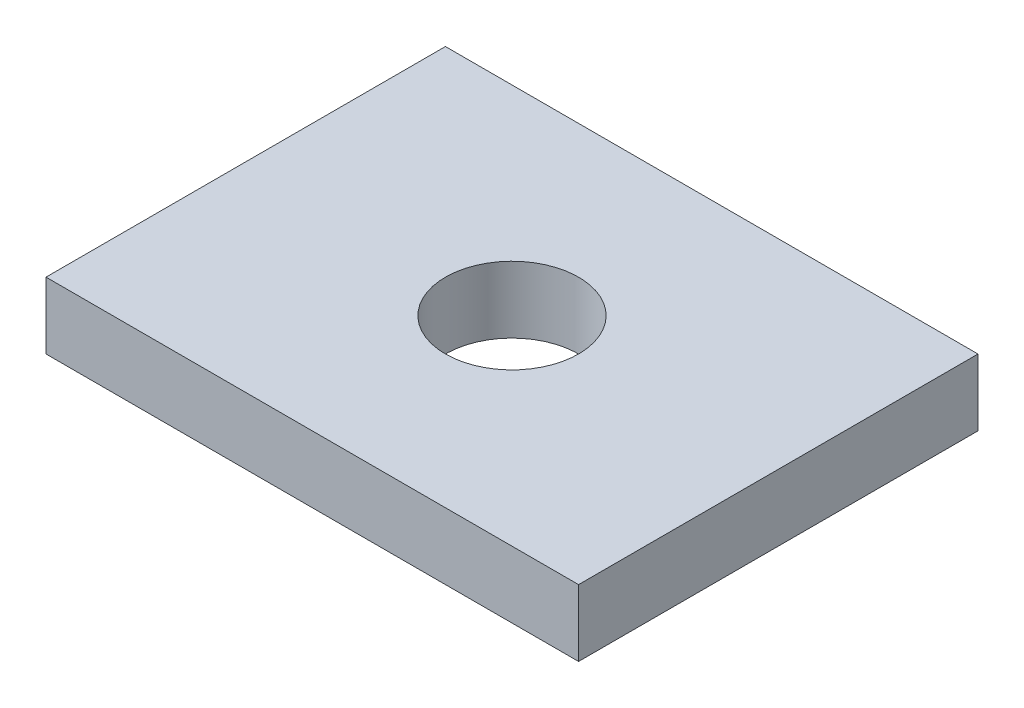
from build123d import *

# Parameters (mm, degrees)
SKETCH1_W           = 80
SKETCH1_H           = 60
SKETCH1_R           = 10
BOSS_EXTRUDE1_DEPTH = 10


with BuildPart() as part:
    # Sketch1 → Boss-Extrude1 (new body)
    with BuildSketch(Plane(origin=(0, 0, 0), x_dir=(1, 0, 0), z_dir=(0, 1, 0))):
        Rectangle(SKETCH1_W, SKETCH1_H)
        with Locations(Location((0, 0, 0), (0, 0, 270))):
            Circle(SKETCH1_R, mode=Mode.SUBTRACT)
    extrude(amount=BOSS_EXTRUDE1_DEPTH)


solid = part.part
